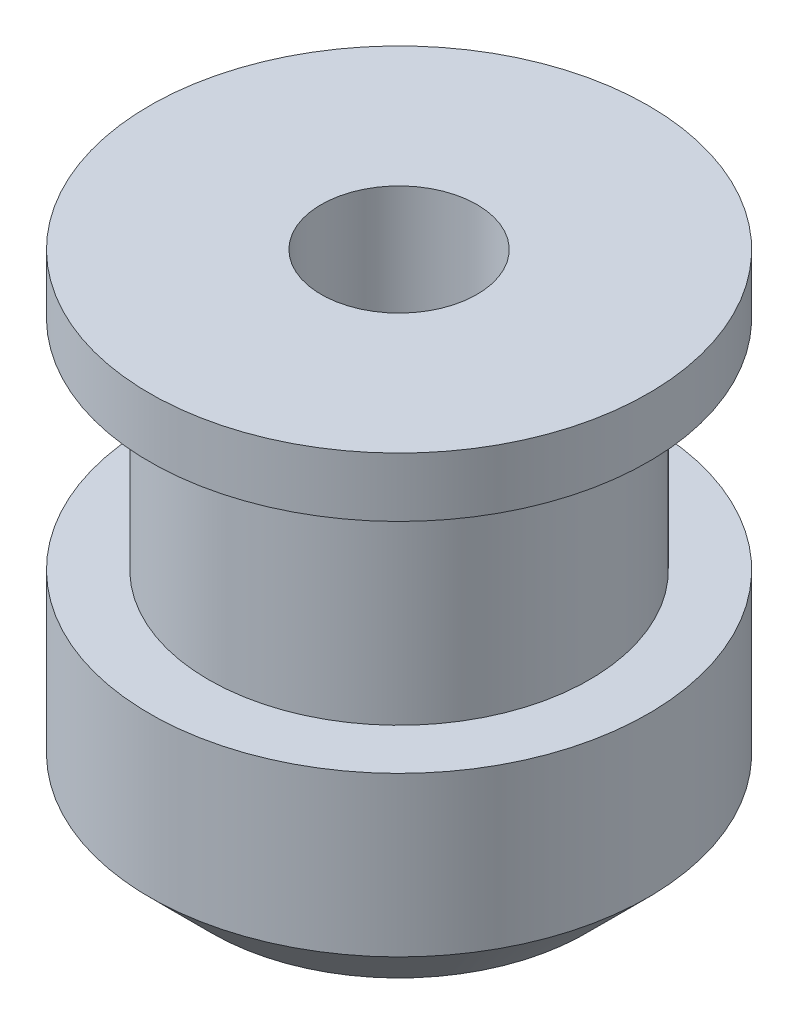
from build123d import *

# Parameters (mm, degrees)
CHAMFER1_SIZE = 2


with BuildPart() as part:
    # Sketch1 → Revolve1 (revolve)
    with BuildSketch(Plane.XY, mode=Mode.PRIVATE) as revolve1_sk:
        Polygon((2.5, 0), (8, 0), (8, 7.1), (6.11, 7.1), (6.11, 14.1), (8, 14.1), (8, 16), (2.5, 16), align=None)
    revolve(revolve1_sk.sketch.rotate(Axis((0, 0, 0), (0, 1, 0)), 90), axis=Axis((0, 0, 0), (0, 1, 0)))

    # Chamfer1
    chamfer1_edges = [part.edges().sort_by_distance(p)[0] for p in [
        (0, 0, 8),
    ]]
    chamfer(chamfer1_edges, length=CHAMFER1_SIZE)


solid = part.part
